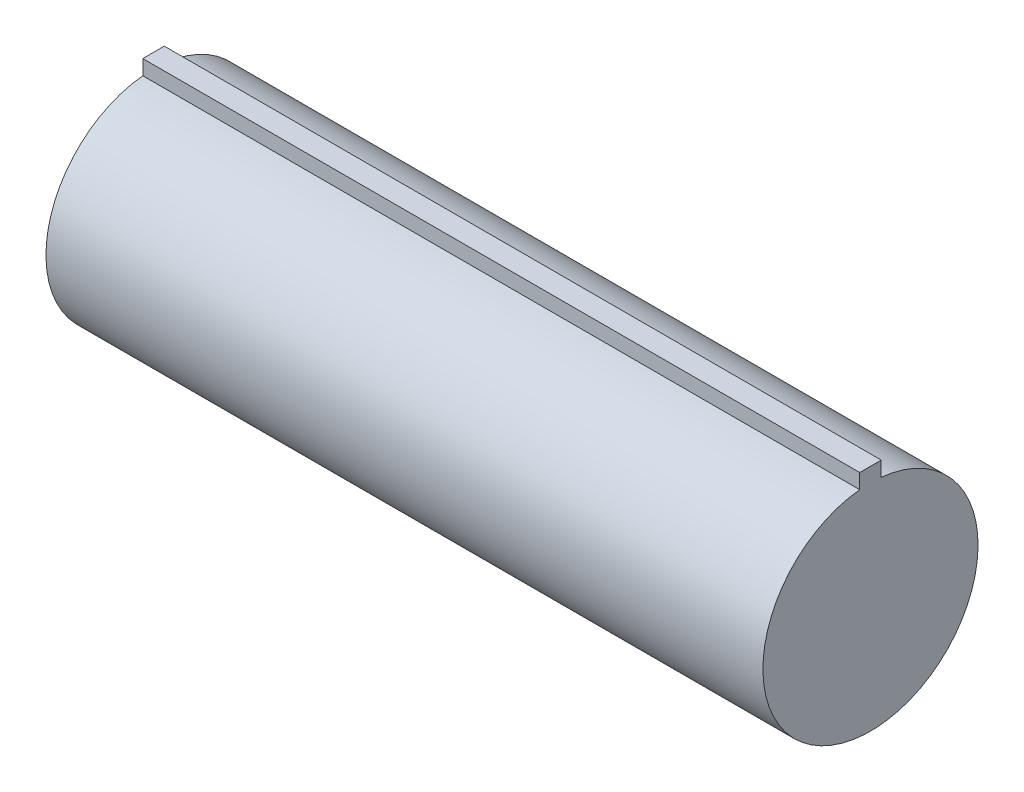
from build123d import *

# Parameters (mm, degrees)
EXTRUDE_1_DEPTH     = 100
SKETCH_2_W          = 6
SKETCH_2_H          = 6
CUT_EXTRUDE_1_DEPTH = 15


with BuildPart() as part:
    # 草图1 → 凸台-拉伸1 (new body)
    with BuildSketch(Plane(origin=(0, 0, 0), x_dir=(0, 0, -1), z_dir=(1, 0, 0))):
        with BuildLine():
            Line((-1.5, 14.924811557), (-1.5, 0))
            Line((-1.5, 0), (1.5, 0))
            Line((1.5, 0), (1.5, 14.924811557))
            ThreePointArc((1.5, 14.924811557), (0, 15), (-1.5, 14.924811557))
        make_face()
        with BuildLine():
            Line((1.5, 0), (-1.5, 0))
            Line((-1.5, 0), (-1.5, 14.924811557))
            ThreePointArc((-1.5, 14.924811557), (-10.062305899, -11.124297731), (15, 0))
            ThreePointArc((15, 0), (11.124297731, 10.062305899), (1.5, 14.924811557))
            Line((1.5, 14.924811557), (1.5, 0))
        make_face()
        with BuildLine():
            Line((-1.5, 17), (-1.5, 14.924811557))
            ThreePointArc((-1.5, 14.924811557), (0, 15), (1.5, 14.924811557))
            Line((1.5, 14.924811557), (1.5, 17))
            Line((1.5, 17), (-1.5, 17))
        make_face()
    extrude(amount=EXTRUDE_1_DEPTH)

    # 草图2 → 切除-拉伸1 (cut)
    with BuildSketch(Plane.ZY):
        Rectangle(SKETCH_2_W, SKETCH_2_H)
    extrude(amount=-CUT_EXTRUDE_1_DEPTH, mode=Mode.SUBTRACT)


solid = part.part
